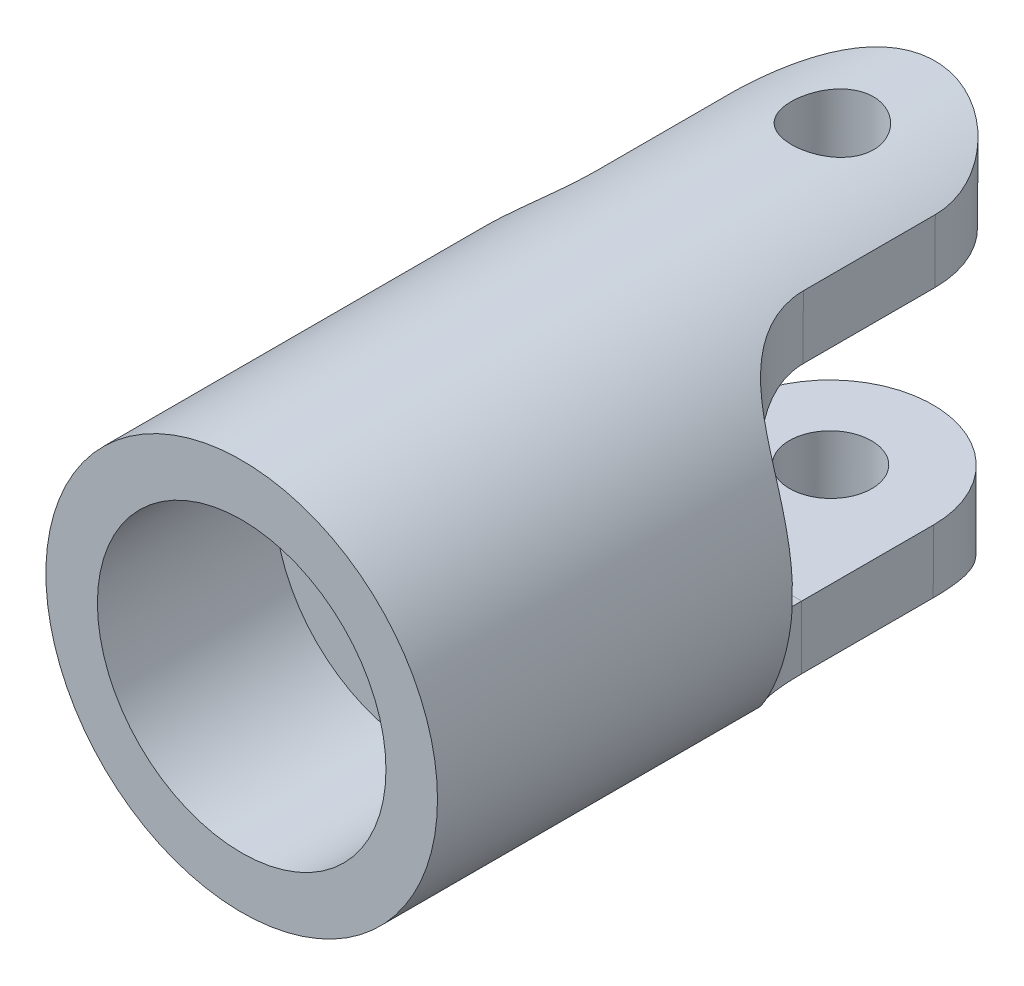
from build123d import *

# Parameters (mm, degrees)
ESQUISSE1_R             = 4.75
BOSS_EXTRU_1_DEPTH      = 16.8
ESQUISSE2_R             = 3.5
ENL_V_MAT_EXTRU_1_DEPTH = 4.3
ESQUISSE3_R             = 2.5
ENL_V_MAT_EXTRU_2_DEPTH = 15.190665946
ENL_V_MAT_EXTRU_3_DEPTH = 20.883036391
ENL_V_MAT_EXTRU_4_DEPTH = 20.883036548
ESQUISSE6_R             = 1
ENL_V_MAT_EXTRU_5_DEPTH = 20.883036548


with BuildPart() as part:
    # Esquisse1 → Boss.-Extru.1 (new body)
    with BuildSketch(Plane.XY):
        Circle(ESQUISSE1_R)
    extrude(amount=BOSS_EXTRU_1_DEPTH)

    # Esquisse2 → Enlèv. mat.-Extru.1 (cut)
    with BuildSketch(Plane.XY.offset(16.8)):
        Circle(ESQUISSE2_R)
    extrude(amount=-ENL_V_MAT_EXTRU_1_DEPTH, mode=Mode.SUBTRACT)

    # Esquisse3 → Enlèv. mat.-Extru.2 (cut, through all)
    with BuildSketch(Plane.XY.offset(12.5)):
        Circle(ESQUISSE3_R)
    extrude(amount=-ENL_V_MAT_EXTRU_2_DEPTH, mode=Mode.SUBTRACT)

    # Esquisse4 → Enlèv. mat.-Extru.3 (cut, through all)
    with BuildSketch(Plane(origin=(-4.749906239, 0.029844934, 0), x_dir=(0, 0, 1), z_dir=(-0.9999802608561372, 0.006283143965558955, 0))):
        with BuildLine():
            Line((0, 2.5), (5.7, 2.5))
            ThreePointArc((5.7, 2.5), (8.2, 0), (5.7, -2.5))
            Line((5.7, -2.5), (0, -2.5))
            Line((0, -2.5), (0, 2.5))
        make_face()
    extrude(amount=-ENL_V_MAT_EXTRU_3_DEPTH, mode=Mode.SUBTRACT)

    # Esquisse5 → Enlèv. mat.-Extru.4 (cut, through all)
    with BuildSketch(Plane(origin=(-0.029844934, -4.749906239, 0), x_dir=(0.9999802608561372, -0.006283143965558958, 0), z_dir=(-0.006283143965558958, -0.9999802608561372, 0))):
        with BuildLine():
            Line((5, 8.2), (8.5, 8.2))
            Line((8.5, 8.2), (8.5, -0.8))
            Line((8.5, -0.8), (-6.868883302, -0.8))
            Line((-6.868883302, -0.8), (-6.868883302, 8.2))
            Line((-6.868883302, 8.2), (-5, 8.2))
            ThreePointArc((-5, 8.2), (-3.232233047, 7.467766953), (-2.5, 5.7))
            Line((-2.5, 5.7), (-2.5, 2.5))
            ThreePointArc((-2.5, 2.5), (0, 0), (2.5, 2.5))
            Line((2.5, 2.5), (2.5, 5.7))
            ThreePointArc((2.5, 5.7), (3.232233047, 7.467766953), (5, 8.2))
        make_face()
    extrude(amount=-ENL_V_MAT_EXTRU_4_DEPTH, mode=Mode.SUBTRACT)

    # Esquisse6 → Enlèv. mat.-Extru.5 (cut, through all)
    with BuildSketch(Plane(origin=(-0.029844934, -4.749906239, 0), x_dir=(0.9999802608561372, -0.006283143965558958, 0), z_dir=(-0.006283143965558958, -0.9999802608561372, 0))):
        with Locations((0, 2.5)):
            Circle(ESQUISSE6_R)
    extrude(amount=-ENL_V_MAT_EXTRU_5_DEPTH, mode=Mode.SUBTRACT)


solid = part.part
